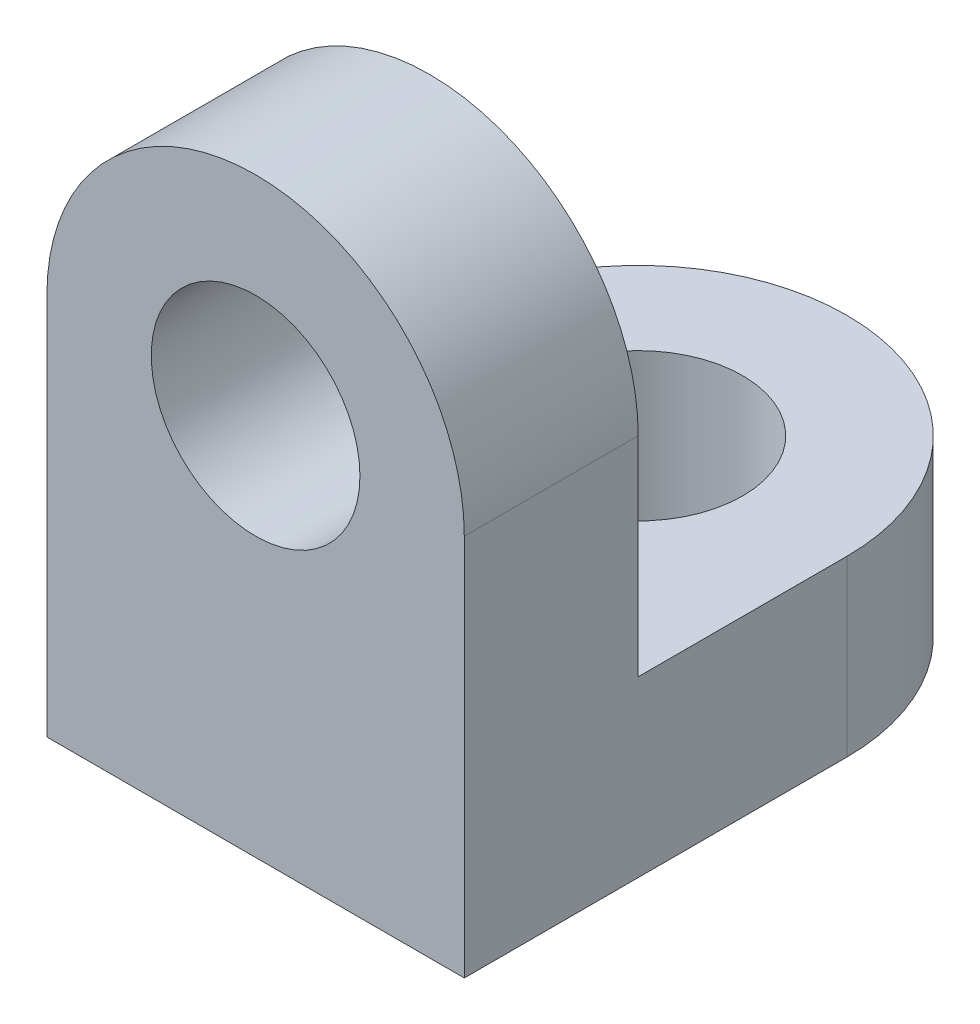
from build123d import *

# Parameters (mm, degrees)
SKETCH1_R           = 6
BOSS_EXTRUDE1_DEPTH = 10
BOSS_EXTRUDE2_DEPTH = 24


with BuildPart() as part:
    # Sketch1 → Boss-Extrude1 (new body)
    with BuildSketch(Plane.XY):
        with BuildLine():
            Line((12, 0), (12, -12))
            Line((12, -12), (-12, -12))
            Line((-12, -12), (-12, 0))
            ThreePointArc((-12, 0), (0, 12), (12, 0))
        make_face()
        Circle(SKETCH1_R, mode=Mode.SUBTRACT)
    extrude(amount=BOSS_EXTRUDE1_DEPTH)

    # Sketch3 → Boss-Extrude2 (add)
    with BuildSketch(Plane.ZY.offset(12)):
        Polygon((0, -12), (10, -22), (10, -12), align=None)
    extrude(amount=-BOSS_EXTRUDE2_DEPTH)

    # Mirror6: part across plane


with BuildPart() as part_1:
    add(part.part)
    add(part.part.mirror(Plane(origin=(26.142135624, -12, 0), x_dir=(0, -0.7071067811865439, 0.7071067811865512), z_dir=(0, -0.7071067811865513, -0.7071067811865438))))


solid = part_1.part
